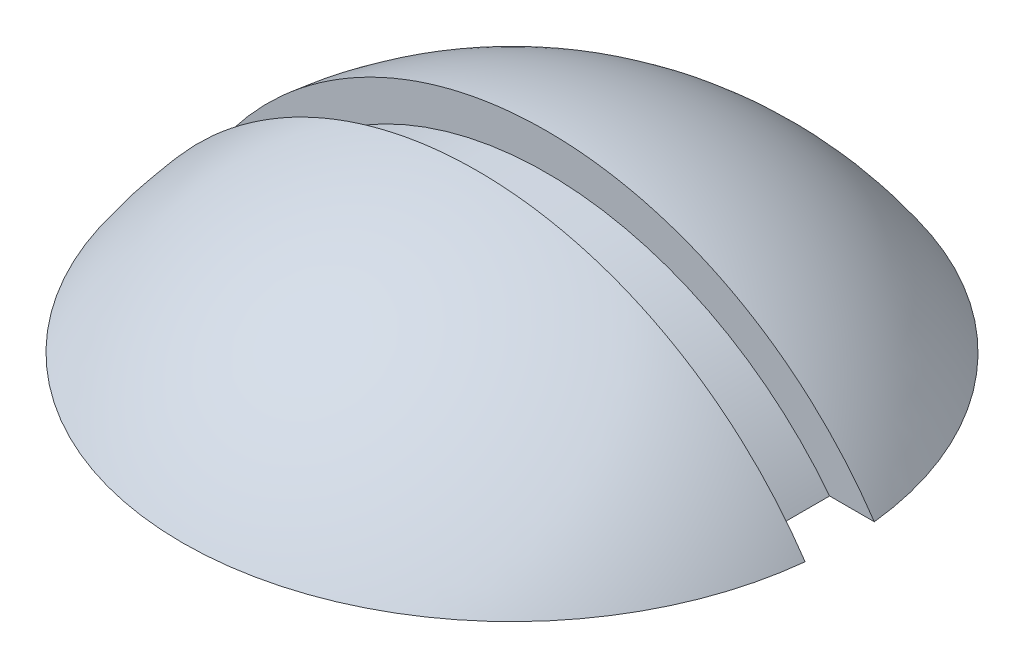
from build123d import *

# Parameters (mm, degrees)
REVOLVE3_ANGLE     = 180
CUT_EXTRUDE2_DEPTH = 6.985


with BuildPart() as part:
    # Sketch1 → Revolve3 (revolve)
    with BuildSketch(Plane.XY):
        with BuildLine():
            Line((-57.135887146, 44.45), (-35.56, 44.45))
            Line((-35.56, 44.45), (-35.56, 57.15))
            Line((-35.56, 57.15), (0, 57.15))
            Line((0, 57.15), (0, 72.39))
            Line((0, 72.39), (0, 80.01))
            ThreePointArc((0, 80.01), (-37.717075708, 70.562187466), (-66.526668337, 44.45))
            Line((-66.526668337, 44.45), (-57.135887146, 44.45))
        make_face()
    revolve3 = revolve(axis=Axis((0, 57.15, 0), (0, 1, 0)), revolution_arc=REVOLVE3_ANGLE)

    # Sketch4 → Cut-Extrude2 (cut)
    with BuildSketch(Plane(origin=(0, 0, 0), x_dir=(-1, 0, 0), z_dir=(0, 0, -1))):
        with BuildLine():
            Line((-66.526668337, 44.45), (-57.135887146, 44.45))
            ThreePointArc((-57.135887146, 44.45), (0, 72.39), (57.135887146, 44.45))
            Line((57.135887146, 44.45), (66.526668337, 44.45))
            ThreePointArc((66.526668337, 44.45), (0, 80.01), (-66.526668337, 44.45))
        make_face()
    cut_extrude2 = extrude(amount=-CUT_EXTRUDE2_DEPTH, mode=Mode.SUBTRACT)

    # Mirror1: Revolve3, Cut-Extrude2 across Front Plane
    add(revolve3.mirror(Plane.XY))
    add(cut_extrude2.mirror(Plane.XY), mode=Mode.SUBTRACT)


solid = part.part
